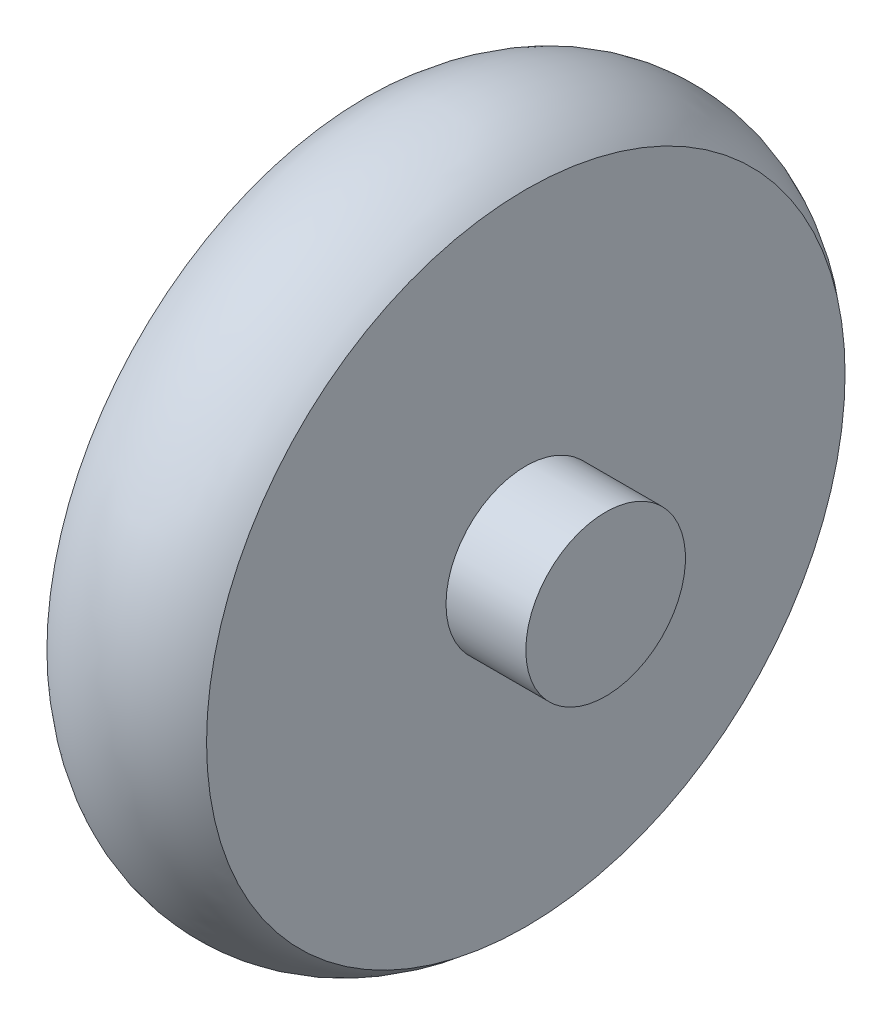
from build123d import *


with BuildPart() as part:
    # 草图1 → 旋转1 (revolve)
    with BuildSketch(Plane.XY, mode=Mode.PRIVATE) as revolve_1_sk:
        with BuildLine():
            Line((20, 0), (30, 0))
            Line((30, 0), (30, 10))
            Line((30, 10), (20, 10))
            Line((20, 10), (20, 40))
            ThreePointArc((20, 40), (10, 43.819660113), (0, 40))
            Line((0, 40), (0, 10))
            Line((0, 10), (-10, 10))
            Line((-10, 10), (-10, 0))
            Line((-10, 0), (0, 0))
            Line((0, 0), (20, 0))
        make_face()
    revolve(revolve_1_sk.sketch.rotate(Axis((0, 0, 0), (1, 0, 0)), 90), axis=Axis((0, 0, 0), (1, 0, 0)))


solid = part.part
